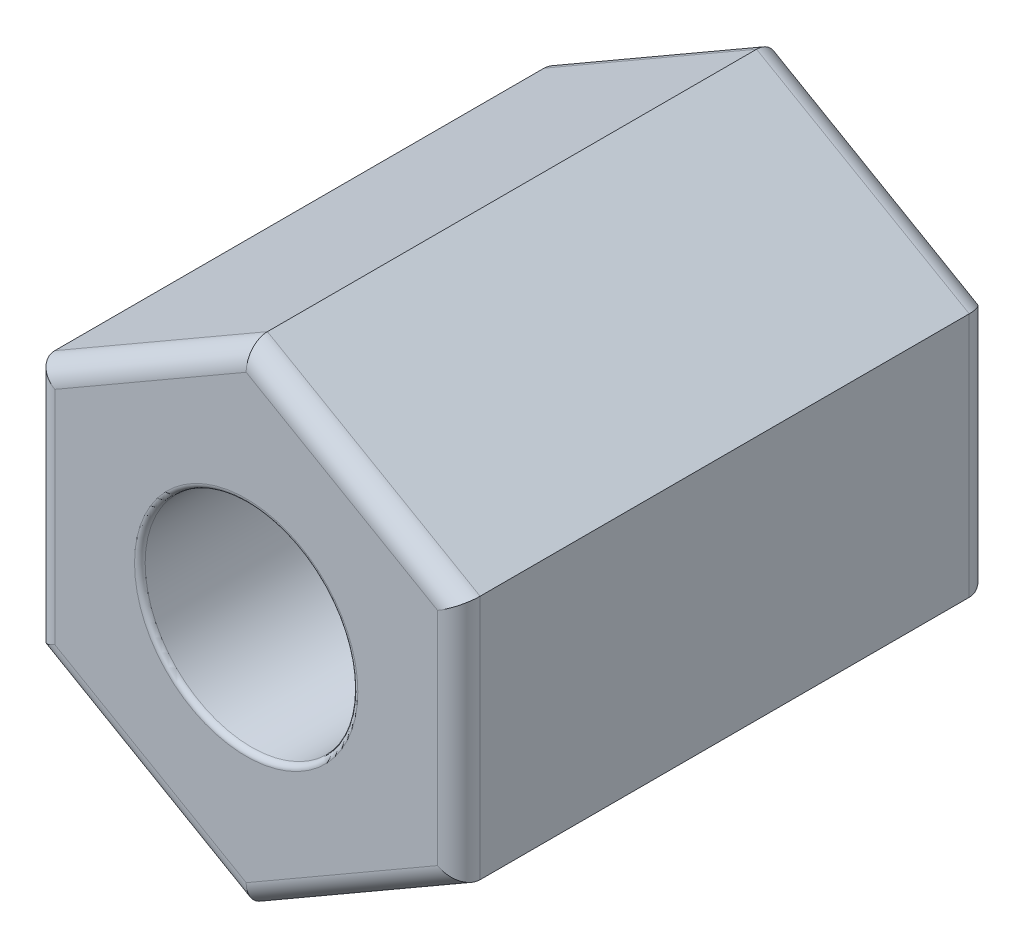
from build123d import *

# Parameters (mm, degrees)
SKETCH_1_R      = 10
EXTRUDE_1_DEPTH = 50
FILLET_1_R      = 2
FILLET_2_R      = 0.5


with BuildPart() as part:
    # 草图1 → 凸台-拉伸1 (new body)
    with BuildSketch(Plane.XY):
        Polygon((0, -23.094010768), (20, -11.547005384), (20, 11.547005384), (0, 23.094010768), (-20, 11.547005384), (-20, -11.547005384), align=None)
        Circle(SKETCH_1_R, mode=Mode.SUBTRACT)
    extrude(amount=EXTRUDE_1_DEPTH)

    # 圆角1
    fillet_1_edges = [part.edges().sort_by_distance(p)[0] for p in [
        (20, 0, 50),
        (10, 17.320508076, 50),
        (-10, 17.320508076, 50),
        (-20, 0, 50),
        (-10, -17.320508076, 50),
        (-20, 0, 0),
        (-10, 17.320508076, 0),
        (10, 17.320508076, 0),
        (10, -17.320508076, 50),
        (20, 0, 0),
        (10, -17.320508076, 0),
        (-10, -17.320508076, 0),
    ]]
    fillet(fillet_1_edges, radius=FILLET_1_R)

    # 圆角2
    fillet_2_edges = [part.edges().sort_by_distance(p)[0] for p in [
        (-10, 0, 0),
        (-10, 0, 50),
    ]]
    fillet(fillet_2_edges, radius=FILLET_2_R)


solid = part.part
